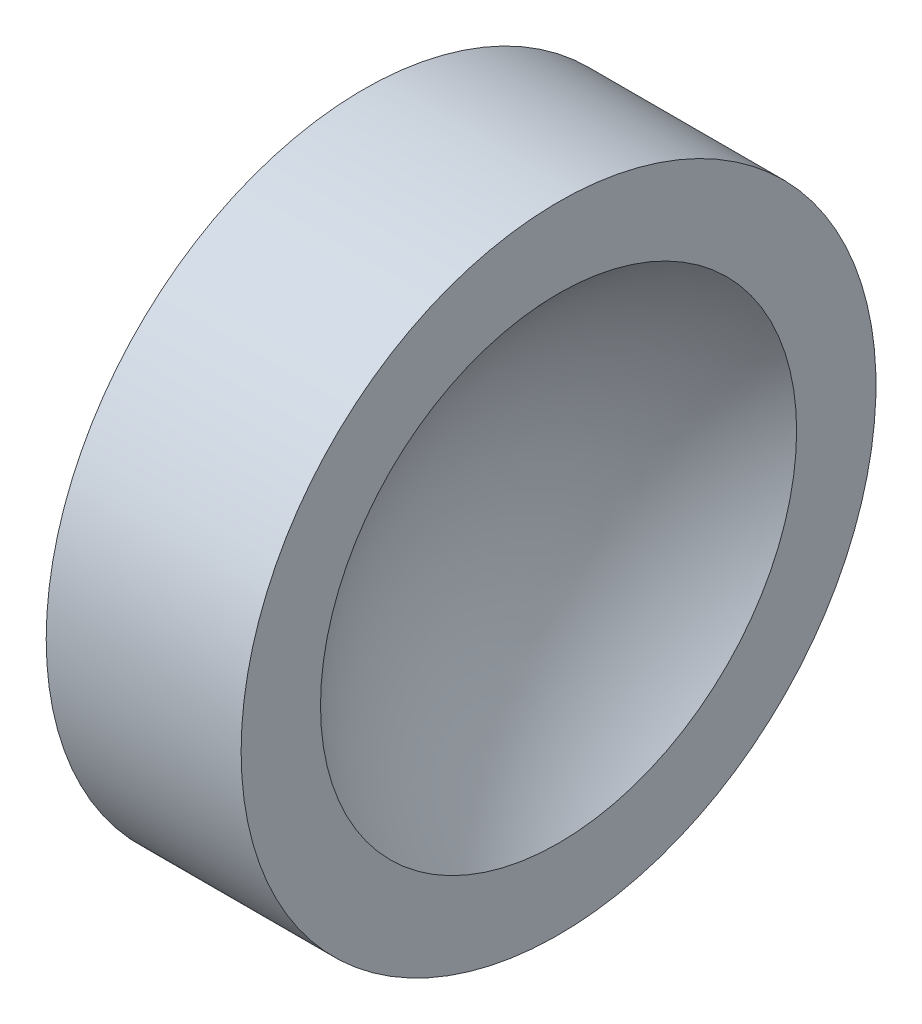
from build123d import *


with BuildPart() as part:
    # 草图1 → 旋转2 (revolve)
    with BuildSketch(Plane.XY):
        with BuildLine():
            Line((0, 2.033859), (0, 0))
            Line((0, 0), (0.624189816, 0))
            ThreePointArc((0.624189816, 0), (0.786424825, 0.824135127), (1.248920393, 1.525289))
            Line((1.248920393, 1.525289), (1.248920393, 2.033859))
            Line((1.248920393, 2.033859), (0, 2.033859))
        make_face()
    revolve(axis=Axis((0, 0, 0), (1, 0, 0)))


solid = part.part
